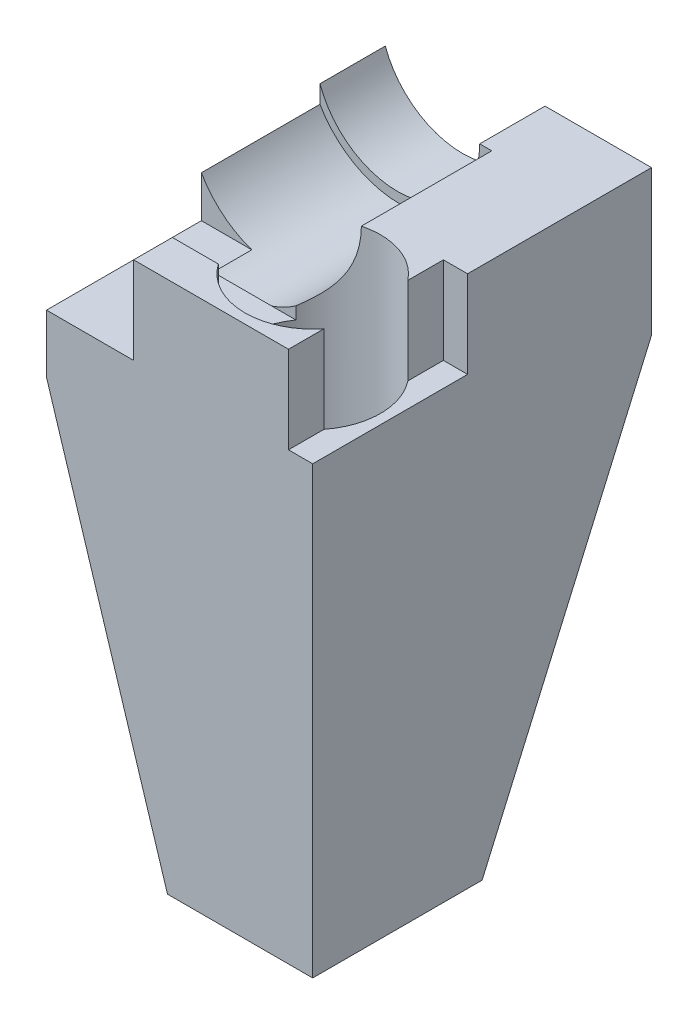
from build123d import *

# Parameters (mm, degrees)
SKETCH1_W           = 55
SKETCH1_H           = 70
BOSS_EXTRUDE1_DEPTH = 110
SKETCH2_R           = 14
CUT_EXTRUDE1_DEPTH  = 108
SKETCH3_W           = 5
SKETCH3_H           = 32
CUT_EXTRUDE2_DEPTH  = 18
SKETCH4_R           = 17
CUT_EXTRUDE3_DEPTH  = 13.5
CUT_EXTRUDE5_REACH  = 137.341
SKETCH5_R           = 19
CUT_EXTRUDE7_REACH  = 143.51
CUT_EXTRUDE8_REACH  = 143.51


with BuildPart() as part:
    # Sketch1 → Boss-Extrude1 (new body)
    with BuildSketch(Plane(origin=(0, 0, 0), x_dir=(1, 0, 0), z_dir=(0, 1, 0))):
        with Locations((27.5, 35)):
            Rectangle(SKETCH1_W, SKETCH1_H)
    extrude(amount=BOSS_EXTRUDE1_DEPTH)

    # Sketch2 → Cut-Extrude1 (cut)
    with BuildSketch(Plane(origin=(0, 110, 0), x_dir=(1, 0, 0), z_dir=(0, 1, 0))):
        with Locations(Location((39, 16, 0), (0, 0, 270))):
            Circle(SKETCH2_R)
    extrude(amount=-CUT_EXTRUDE1_DEPTH, mode=Mode.SUBTRACT)

    # Sketch3 → Cut-Extrude2 (cut)
    with BuildSketch(Plane(origin=(0, 110, 0), x_dir=(1, 0, 0), z_dir=(0, 1, 0))):
        with Locations((52.5, 16)):
            Rectangle(SKETCH3_W, SKETCH3_H)
        Polygon((0, 0), (18, 0), (18, 8), (31.332818552, 8), (31.332818552, 24), (18, 24), (18, 32), (0, 32), align=None)
    extrude(amount=-CUT_EXTRUDE2_DEPTH, mode=Mode.SUBTRACT)

    # Sketch4 → Cut-Extrude3 (cut)
    with BuildSketch(Plane(origin=(0, 0, -70), x_dir=(-1, 0, 0), z_dir=(0, 0, -1))):
        with Locations((-16, 110)):
            Circle(SKETCH4_R)
    extrude(amount=-CUT_EXTRUDE3_DEPTH, mode=Mode.SUBTRACT)

    # Cut-Extrude5: up to this face of the body (flat: up to its plane)
    cut_extrude5_end = Plane(part.part.faces().sort_by_distance((22.755437353, 101, -24))[0])
    # Sketch5 → Cut-Extrude5 (cut, up to the picked face)
    with BuildSketch(Plane(origin=(0, 0, -56.5), x_dir=(-1, 0, 0), z_dir=(0, 0, -1)), mode=Mode.PRIVATE) as cut_extrude5_sk1:
        with Locations((-16.5, 110)):
            Circle(SKETCH5_R)
    cut_extrude5_tool1 = split(extrude(cut_extrude5_sk1.sketch, amount=-CUT_EXTRUDE5_REACH, mode=Mode.PRIVATE), bisect_by=cut_extrude5_end, keep=Keep.BOTH, mode=Mode.PRIVATE)
    add(cut_extrude5_tool1.solids().sort_by(Axis((16.5, 110, -56.5), (0, 0, 1)))[0], mode=Mode.SUBTRACT)

    # Sketch8 → Cut-Extrude7 (cut, up to next)
    with BuildSketch(Plane(origin=(55, 0, 0), x_dir=(0, 0, -1), z_dir=(1, 0, 0)), mode=Mode.PRIVATE) as cut_extrude7_sk1:
        Polygon((70, 0), (70, 80), (35, 0), align=None)
    cut_extrude7_tool1 = extrude(cut_extrude7_sk1.sketch, amount=-CUT_EXTRUDE7_REACH, mode=Mode.PRIVATE) & part.part
    add(cut_extrude7_tool1.solids().sort_by_distance((55, 26.666667, -58.333333))[0], mode=Mode.SUBTRACT)

    # Cut-Extrude8: up to this plane
    cut_extrude8_end = Plane(origin=(-0.001, 80, -70), z_dir=(0, 0.40081883401970747, 0.9161573349021893))
    # Sketch9 → Cut-Extrude8 (cut, up to the surface)
    with BuildSketch(Plane.XY, mode=Mode.PRIVATE) as cut_extrude8_sk1:
        Polygon((0, 0), (25, 0), (0, 80), align=None)
    cut_extrude8_tool1 = split(extrude(cut_extrude8_sk1.sketch, amount=-CUT_EXTRUDE8_REACH, mode=Mode.PRIVATE), bisect_by=cut_extrude8_end, keep=Keep.BOTH, mode=Mode.PRIVATE)
    add(cut_extrude8_tool1.solids().sort_by_distance((8.333333, 26.666667, 0))[0], mode=Mode.SUBTRACT)


solid = part.part
